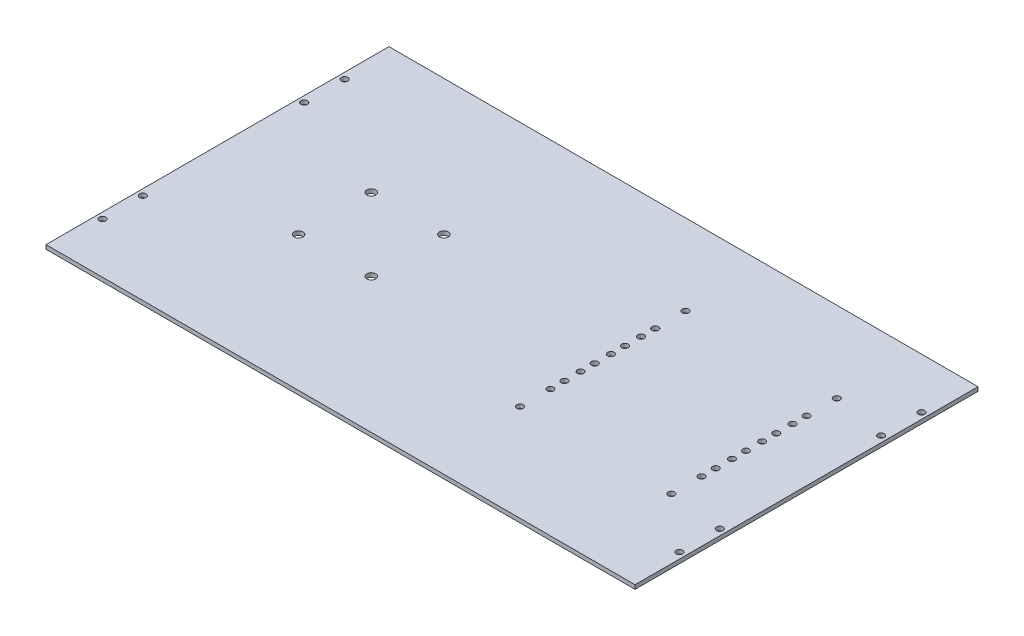
from build123d import *

# Parameters (mm, degrees)
SKETCH_1_W      = 292
SKETCH_1_H      = 170
SKETCH_1_R      = 1.6
SKETCH_1_R_2    = 2.2
EXTRUDE_1_DEPTH = 2


with BuildPart() as part:
    # 草图1 → 凸台-拉伸1 (new body)
    with BuildSketch(Plane(origin=(0, 0, 0), x_dir=(1, 0, 0), z_dir=(0, 1, 0))):
        with Locations((146, 85)):
            Rectangle(SKETCH_1_W, SKETCH_1_H)
        with Locations(Location((3, 145, 0), (0, 0, 270))):
            Circle(SKETCH_1_R, mode=Mode.SUBTRACT)
        with Locations(Location((3, 125, 0), (0, 0, 270))):
            Circle(SKETCH_1_R, mode=Mode.SUBTRACT)
        with Locations(Location((3, 45, 0), (0, 0, 270))):
            Circle(SKETCH_1_R, mode=Mode.SUBTRACT)
        with Locations(Location((3, 25, 0), (0, 0, 270))):
            Circle(SKETCH_1_R, mode=Mode.SUBTRACT)
        with Locations(Location((289, 25, 0), (0, 0, 90))):
            Circle(SKETCH_1_R, mode=Mode.SUBTRACT)
        with Locations(Location((289, 45, 0), (0, 0, 90))):
            Circle(SKETCH_1_R, mode=Mode.SUBTRACT)
        with Locations(Location((289, 125, 0), (0, 0, 90))):
            Circle(SKETCH_1_R, mode=Mode.SUBTRACT)
        with Locations(Location((289, 145, 0), (0, 0, 90))):
            Circle(SKETCH_1_R, mode=Mode.SUBTRACT)
        with Locations(Location((187, 130, 0), (0, 0, 270))):
            Circle(SKETCH_1_R, mode=Mode.SUBTRACT)
        with Locations(Location((262, 130, 0), (0, 0, 270))):
            Circle(SKETCH_1_R, mode=Mode.SUBTRACT)
        with Locations(Location((262, 108, 0), (0, 0, 270))):
            Circle(SKETCH_1_R, mode=Mode.SUBTRACT)
        with Locations(Location((187, 108, 0), (0, 0, 270))):
            Circle(SKETCH_1_R, mode=Mode.SUBTRACT)
        with Locations(Location((187, 115, 0), (0, 0, 270))):
            Circle(SKETCH_1_R, mode=Mode.SUBTRACT)
        with Locations(Location((262, 115, 0), (0, 0, 270))):
            Circle(SKETCH_1_R, mode=Mode.SUBTRACT)
        with Locations(Location((187, 93, 0), (0, 0, 270))):
            Circle(SKETCH_1_R, mode=Mode.SUBTRACT)
        with Locations(Location((262, 93, 0), (0, 0, 270))):
            Circle(SKETCH_1_R, mode=Mode.SUBTRACT)
        with Locations(Location((187, 100, 0), (0, 0, 270))):
            Circle(SKETCH_1_R, mode=Mode.SUBTRACT)
        with Locations(Location((262, 100, 0), (0, 0, 270))):
            Circle(SKETCH_1_R, mode=Mode.SUBTRACT)
        with Locations(Location((187, 78, 0), (0, 0, 270))):
            Circle(SKETCH_1_R, mode=Mode.SUBTRACT)
        with Locations(Location((262, 78, 0), (0, 0, 270))):
            Circle(SKETCH_1_R, mode=Mode.SUBTRACT)
        with Locations(Location((187, 85, 0), (0, 0, 270))):
            Circle(SKETCH_1_R, mode=Mode.SUBTRACT)
        with Locations(Location((262, 85, 0), (0, 0, 270))):
            Circle(SKETCH_1_R, mode=Mode.SUBTRACT)
        with Locations(Location((187, 63, 0), (0, 0, 270))):
            Circle(SKETCH_1_R, mode=Mode.SUBTRACT)
        with Locations(Location((262, 63, 0), (0, 0, 270))):
            Circle(SKETCH_1_R, mode=Mode.SUBTRACT)
        with Locations(Location((187, 70, 0), (0, 0, 270))):
            Circle(SKETCH_1_R, mode=Mode.SUBTRACT)
        with Locations(Location((262, 70, 0), (0, 0, 270))):
            Circle(SKETCH_1_R, mode=Mode.SUBTRACT)
        with Locations(Location((187, 48, 0), (0, 0, 270))):
            Circle(SKETCH_1_R, mode=Mode.SUBTRACT)
        with Locations(Location((262, 48, 0), (0, 0, 270))):
            Circle(SKETCH_1_R, mode=Mode.SUBTRACT)
        with Locations(Location((58.224948847, 103, 0), (0, 0, 270))):
            Circle(SKETCH_1_R_2, mode=Mode.SUBTRACT)
        with Locations(Location((94.224948847, 103, 0), (0, 0, 270))):
            Circle(SKETCH_1_R_2, mode=Mode.SUBTRACT)
        with Locations(Location((94.224948847, 67, 0), (0, 0, 270))):
            Circle(SKETCH_1_R_2, mode=Mode.SUBTRACT)
        with Locations(Location((58.224948847, 67, 0), (0, 0, 270))):
            Circle(SKETCH_1_R_2, mode=Mode.SUBTRACT)
    extrude(amount=EXTRUDE_1_DEPTH)


solid = part.part
